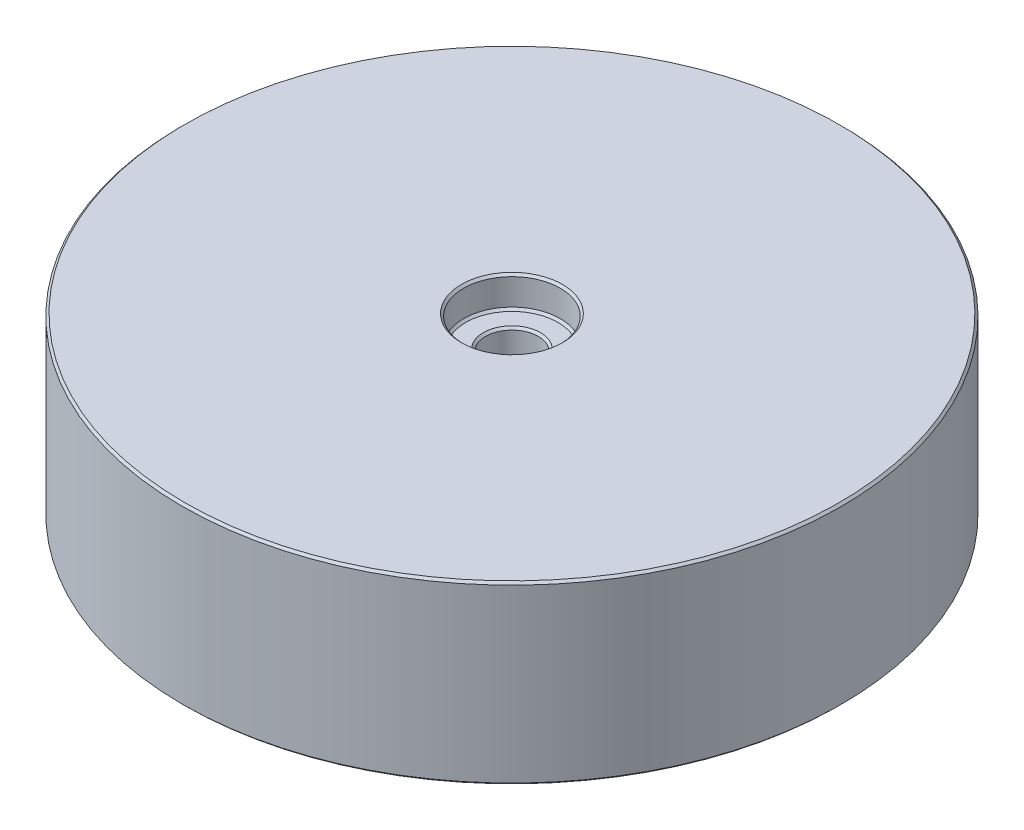
from build123d import *

# Parameters (mm, degrees)
SKETCH3_R          = 1.5
CUT_EXTRUDE1_DEPTH = 15
SKETCH4_R          = 20.5
SKETCH4_R_2        = 14.5
CUT_EXTRUDE2_DEPTH = 10
CHAMFER1_SIZE      = 1


with BuildPart() as part:
    # Sketch2 → Revolve1 (revolve)
    with BuildSketch(Plane(origin=(0, 0, 0), x_dir=(0, 0, -1), z_dir=(1, 0, 0))):
        Polygon((-6, 12.5), (-6, -12.5), (-6.5, -13), (-10.5, -13), (-11, -13.5), (-11, -19.5), (-11.5, -20), (-36.5, -20), (-37, -19.5), (-37, -10.5), (-37.5, -10), (-71.5, -10), (-72, -10.5), (-72, -19.5), (-72.5, -20), (-74.5, -20), (-75, -19.5), (-75, 19.5), (-74.5, 20), (-72.5, 20), (-37, 20), (-36.5, 20), (-11.5, 20), (-11, 19.5), (-11, 13.5), (-10.5, 13), (-6.5, 13), align=None)
    revolve(axis=Axis((0, 77.621858512, 0), (0, -1, 0)))

    # Sketch3 → Cut-Extrude1 (cut)
    with BuildSketch(Plane.XZ.offset(10)):
        with Locations(Location((-45.961940777, 45.961940777, 0), (0, 0, 270))):
            Circle(SKETCH3_R)
        with Locations(Location((-31.112698372, 31.112698372, 0), (0, 0, 270))):
            Circle(SKETCH3_R)
        with Locations(Location((31.112698372, 31.112698372, 0), (0, 0, 270))):
            Circle(SKETCH3_R)
        with Locations(Location((45.961940777, 45.961940777, 0), (0, 0, 270))):
            Circle(SKETCH3_R)
        with Locations(Location((-65, 0, 0), (0, 0, 270))):
            Circle(SKETCH3_R)
        with Locations(Location((-44, 0, 0), (0, 0, 270))):
            Circle(SKETCH3_R)
        with Locations(Location((-45.961940777, -45.961940777, 0), (0, 0, 270))):
            Circle(SKETCH3_R)
        with Locations(Location((-31.112698372, -31.112698372, 0), (0, 0, 270))):
            Circle(SKETCH3_R)
        with Locations(Location((0, -44, 0), (0, 0, 270))):
            Circle(SKETCH3_R)
        with Locations(Location((0, -65, 0), (0, 0, 270))):
            Circle(SKETCH3_R)
        with Locations(Location((31.112698372, -31.112698372, 0), (0, 0, 270))):
            Circle(SKETCH3_R)
        with Locations(Location((45.961940777, -45.961940777, 0), (0, 0, 270))):
            Circle(SKETCH3_R)
        with Locations(Location((44, 0, 0), (0, 0, 270))):
            Circle(SKETCH3_R)
        with Locations(Location((65, 0, 0), (0, 0, 270))):
            Circle(SKETCH3_R)
        with Locations(Location((0, 44, 0), (0, 0, 270))):
            Circle(SKETCH3_R)
        with Locations(Location((0, 65, 0), (0, 0, 270))):
            Circle(SKETCH3_R)
    extrude(amount=-CUT_EXTRUDE1_DEPTH, mode=Mode.SUBTRACT)

    # Sketch4 → Cut-Extrude2 (cut)
    with BuildSketch(Plane(origin=(0, -20, 0), x_dir=(1, 0, 0), z_dir=(0, 1, 0))):
        with Locations(Location((0, 0, 0), (0, 0, 270))):
            Circle(SKETCH4_R)
        with Locations(Location((0, 0, 0), (0, 0, 270))):
            Circle(SKETCH4_R_2, mode=Mode.SUBTRACT)
    extrude(amount=CUT_EXTRUDE2_DEPTH, mode=Mode.SUBTRACT)

    # Chamfer1
    chamfer1_edges = [part.edges().sort_by_distance(p)[0] for p in [
        (0, -20, -14.5),
        (0, -20, -20.5),
    ]]
    chamfer(chamfer1_edges, length=CHAMFER1_SIZE)


solid = part.part
